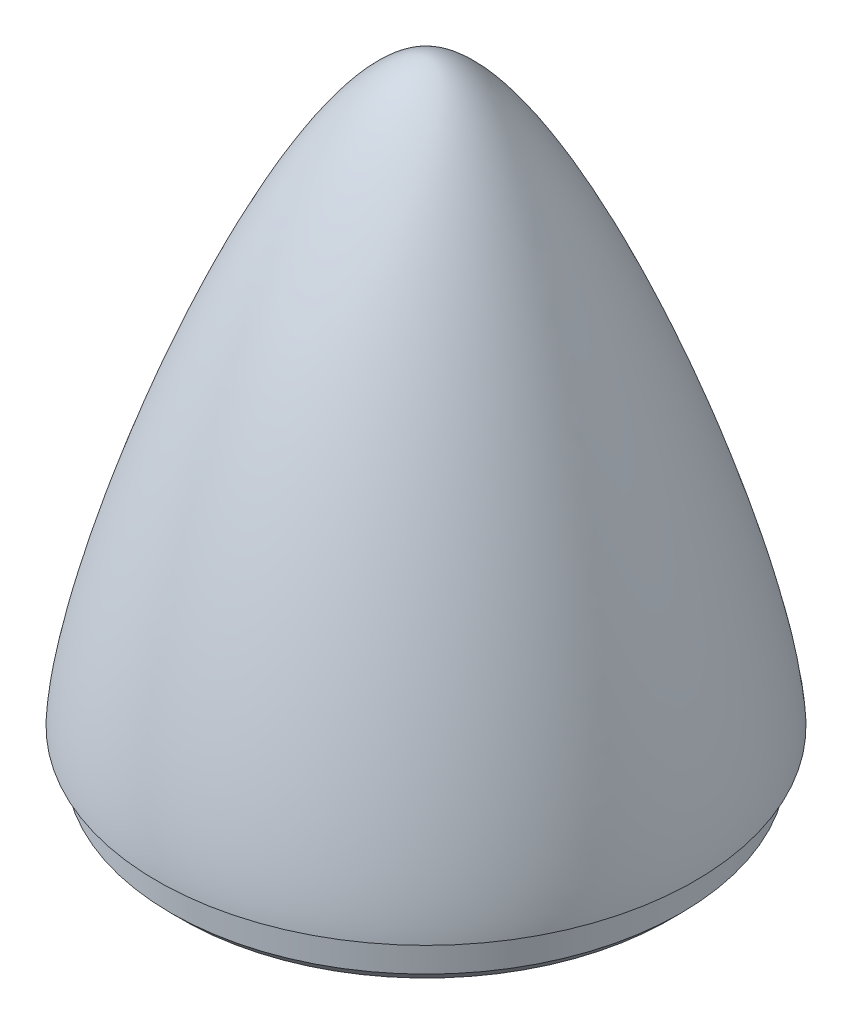
from build123d import *


with BuildPart() as part:
    # Sketch2 → Revolve3 (revolve)
    with BuildSketch(Plane.XY, mode=Mode.PRIVATE) as revolve3_sk:
        with BuildLine():
            Line((0, 118.28214657), (-21, 118.28214657))
            Line((-21, 118.28214657), (-22, 119.28214657))
            Line((-22, 119.28214657), (-22, 122.28214657))
            Line((-22, 122.28214657), (-23.2, 122.28214657))
            add(Edge.make_bspline(
                [(-23.2, 122.28214657), (-22.674392893, 133.228168876), (-8.913698546, 172.11452311), (0, 172.28214657)],
                knots=[0, 0, 0, 0, 1, 1, 1, 1], degree=3))
            Line((0, 172.28214657), (0, 118.28214657))
        make_face()
    revolve(revolve3_sk.sketch.rotate(Axis((0, 122.28214657, 0), (0, 1, 0)), 270), axis=Axis((0, 122.28214657, 0), (0, 1, 0)))


solid = part.part
